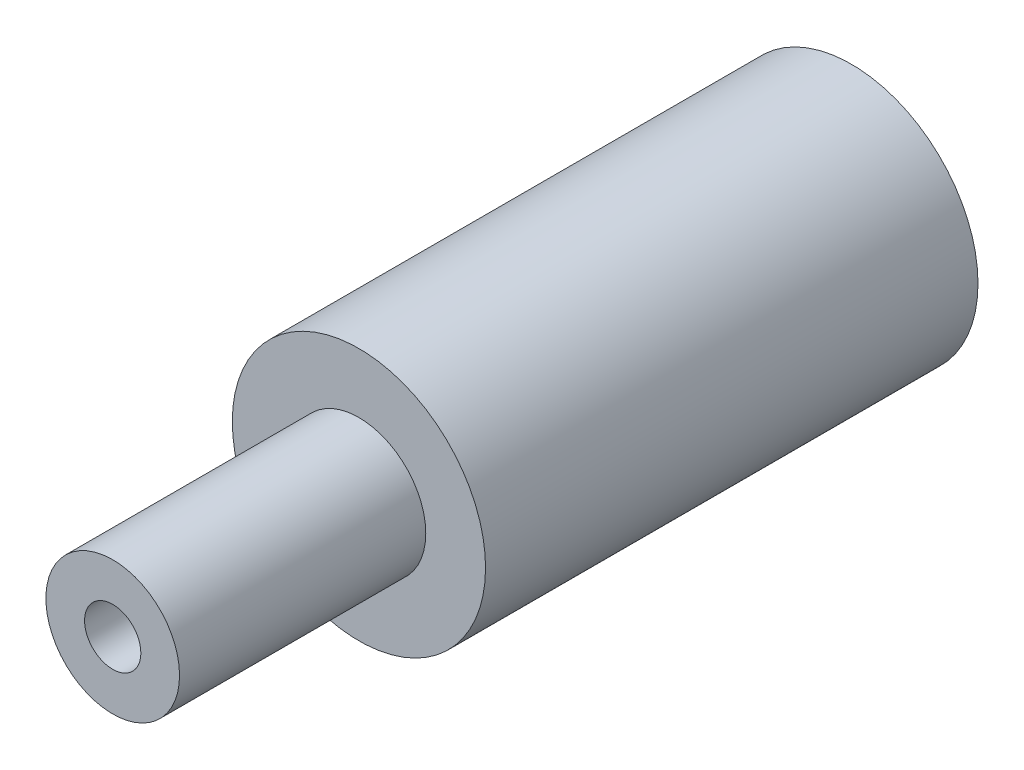
from build123d import *

# Parameters (mm, degrees)
SKETCH1_R           = 18
BOSS_EXTRUDE1_DEPTH = 70
SKETCH2_R           = 2.5
BOSS_EXTRUDE2_DEPTH = 16
SKETCH3_R           = 9.5
SKETCH3_R_2         = 2.5
BOSS_EXTRUDE3_DEPTH = 25
SKETCH4_R           = 9.5
SKETCH4_R_2         = 4
BOSS_EXTRUDE4_DEPTH = 10


with BuildPart() as part:
    # Sketch1 → Boss-Extrude1 (new body)
    with BuildSketch(Plane.XY):
        Circle(SKETCH1_R)
    extrude(amount=BOSS_EXTRUDE1_DEPTH)

    # Sketch2 → Boss-Extrude2 (add)
    with BuildSketch(Plane.XY.offset(70)):
        Circle(SKETCH2_R)
    extrude(amount=BOSS_EXTRUDE2_DEPTH)

    # Sketch3 → Boss-Extrude3 (add)
    with BuildSketch(Plane.XY.offset(70)):
        Circle(SKETCH3_R)
        Circle(SKETCH3_R_2, mode=Mode.SUBTRACT)
    extrude(amount=BOSS_EXTRUDE3_DEPTH)

    # Sketch4 → Boss-Extrude4 (add)
    with BuildSketch(Plane.XY.offset(95)):
        Circle(SKETCH4_R)
        Circle(SKETCH4_R_2, mode=Mode.SUBTRACT)
    extrude(amount=BOSS_EXTRUDE4_DEPTH)


solid = part.part
